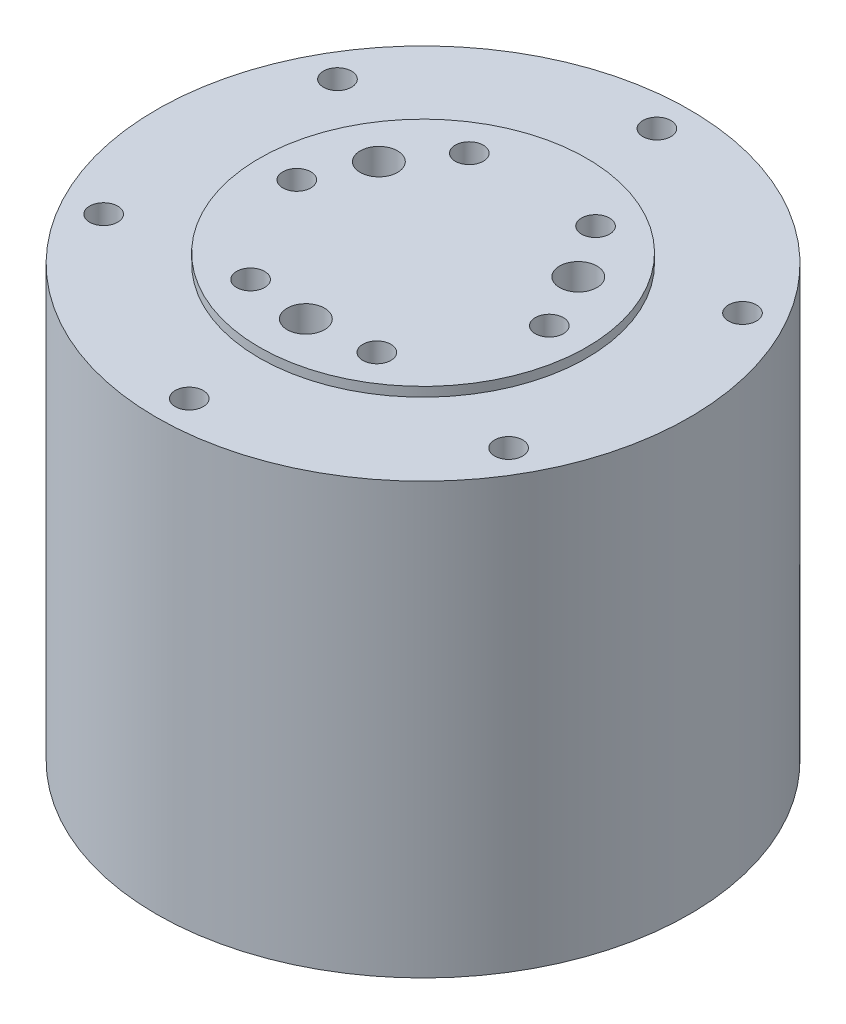
from build123d import *

# Parameters (mm, degrees)
SKETCH_1_R               = 28.5
EXTRUDE_1_DEPTH          = 46
SKETCH_2_R               = 17.5
EXTRUDE_2_DEPTH          = 1
SKETCH_4_R               = 1.5
CUT_EXTRUDE_1_DEPTH      = 4
PATTERN_CIRCULAR_1_COUNT = 4
SKETCH_5_R               = 2
CUT_EXTRUDE_2_DEPTH      = 4
PATTERN_CIRCULAR_2_COUNT = 3
SKETCH_6_R               = 1.5
CUT_EXTRUDE_3_DEPTH      = 5
PATTERN_CIRCULAR_3_COUNT = 6
SKETCH_8_R               = 1.5
CUT_EXTRUDE_4_DEPTH      = 5
PATTERN_CIRCULAR_4_COUNT = 6


with BuildPart() as part:
    # 草图1 → 凸台-拉伸1 (new body)
    with BuildSketch(Plane(origin=(0, 0, 0), x_dir=(1, 0, 0), z_dir=(0, 1, 0))):
        with Locations(Location((0, 0, 0), (0, 0, 270))):
            Circle(SKETCH_1_R)
    extrude(amount=EXTRUDE_1_DEPTH)

    # 草图2 → 凸台-拉伸2 (add)
    with BuildSketch(Plane(origin=(0, 46, 0), x_dir=(1, 0, 0), z_dir=(0, 1, 0))):
        with Locations(Location((0, 0, 0), (0, 0, 270))):
            Circle(SKETCH_2_R)
    extrude(amount=EXTRUDE_2_DEPTH)

    # 草图4 → 切除-拉伸1 (cut)
    with BuildSketch(Plane.XZ):
        with Locations(Location((13.435028843, 13.435028843, 0), (0, 0, 270))):
            Circle(SKETCH_4_R)
    cut_extrude_1 = extrude(amount=-CUT_EXTRUDE_1_DEPTH, mode=Mode.SUBTRACT)

    # 阵列(圆周)1: 切除-拉伸1 ×4 about axis
    pattern_circular_1_axis = Axis((0, 0, 0), (0, 1, 0))
    for i in range(1, PATTERN_CIRCULAR_1_COUNT):
        add(cut_extrude_1.rotate(pattern_circular_1_axis, i * 360 / PATTERN_CIRCULAR_1_COUNT), mode=Mode.SUBTRACT)

    # 草图5 → 切除-拉伸2 (cut)
    with BuildSketch(Plane(origin=(0, 47, 0), x_dir=(1, 0, 0), z_dir=(0, 1, 0))):
        with Locations(Location((10.522208656, 6.075, 0), (0, 0, 270))):
            Circle(SKETCH_5_R)
    cut_extrude_2 = extrude(amount=-CUT_EXTRUDE_2_DEPTH, mode=Mode.SUBTRACT)

    # 阵列(圆周)2: 切除-拉伸2 ×3 about axis
    pattern_circular_2_axis = Axis((-0.139251727, 0, 0.080397022), (0, 1, 0))
    for i in range(1, PATTERN_CIRCULAR_2_COUNT):
        add(cut_extrude_2.rotate(pattern_circular_2_axis, i * 360 / PATTERN_CIRCULAR_2_COUNT), mode=Mode.SUBTRACT)

    # 草图6 → 切除-拉伸3 (cut)
    with BuildSketch(Plane(origin=(0, 47, 0), x_dir=(1, 0, 0), z_dir=(0, 1, 0))):
        with Locations(Location((13.5, 0, 0), (0, 0, 270))):
            Circle(SKETCH_6_R)
    cut_extrude_3 = extrude(amount=-CUT_EXTRUDE_3_DEPTH, mode=Mode.SUBTRACT)

    # 阵列(圆周)3: 切除-拉伸3 ×6 about axis
    pattern_circular_3_axis = Axis((0, 0, 0), (0, 1, 0))
    for i in range(1, PATTERN_CIRCULAR_3_COUNT):
        add(cut_extrude_3.rotate(pattern_circular_3_axis, i * 360 / PATTERN_CIRCULAR_3_COUNT), mode=Mode.SUBTRACT)

    # 草图8 → 切除-拉伸4 (cut)
    with BuildSketch(Plane(origin=(0, 46, 0), x_dir=(1, 0, 0), z_dir=(0, 1, 0))):
        with Locations(Location((0, 25, 0), (0, 0, 270))):
            Circle(SKETCH_8_R)
    cut_extrude_4 = extrude(amount=-CUT_EXTRUDE_4_DEPTH, mode=Mode.SUBTRACT)

    # 阵列(圆周)4: 切除-拉伸4 ×6 about axis
    pattern_circular_4_axis = Axis((0, 0, 0), (0, 1, 0))
    for i in range(1, PATTERN_CIRCULAR_4_COUNT):
        add(cut_extrude_4.rotate(pattern_circular_4_axis, i * 360 / PATTERN_CIRCULAR_4_COUNT), mode=Mode.SUBTRACT)


solid = part.part
